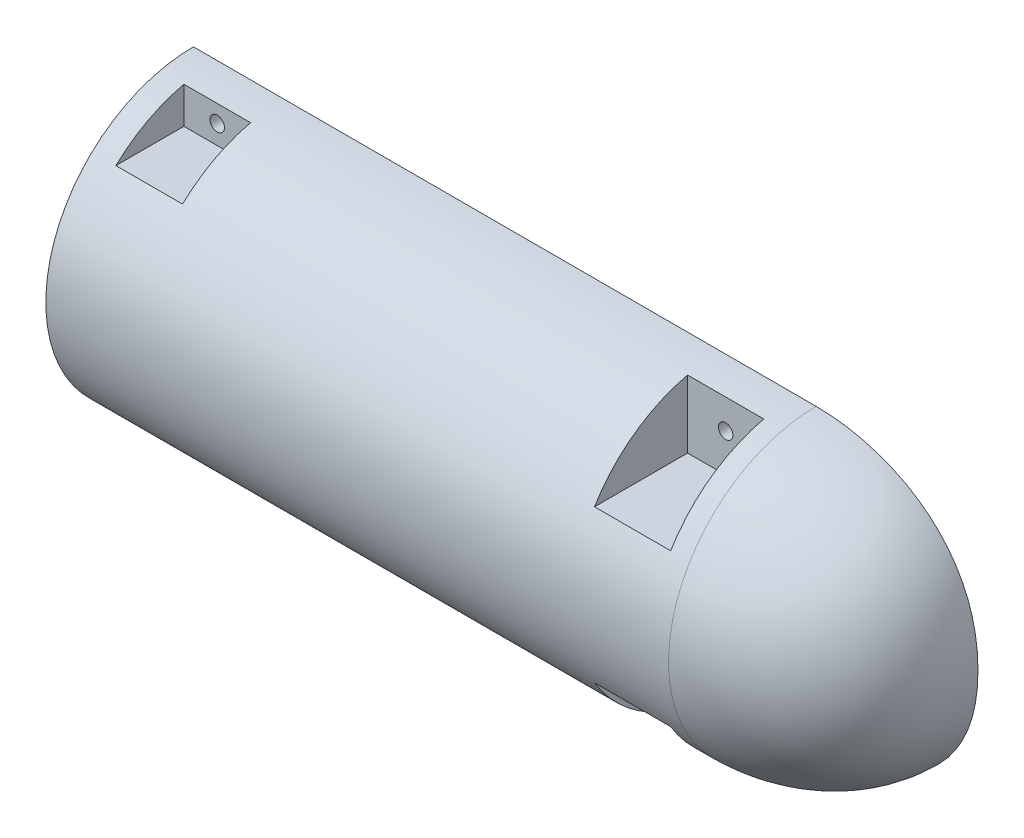
from build123d import *

# Parameters (mm, degrees)
REVOLVE1_ANGLE          = 180
CUT_EXTRUDE1_REACH      = 114.566
CUT_EXTRUDE1_END_RADIUS = 31
SKETCH2_W               = 14
SKETCH2_H               = 8.465653043
SKETCH2_W_2             = 16
SKETCH2_H_2             = 15
CUT_EXTRUDE2_REACH      = 114.566
SKETCH3_R               = 1.525
CUT_EXTRUDE3_DEPTH      = 10
CUT_EXTRUDE4_REACH      = 128.25
SKETCH6_R               = 8.5


with BuildPart() as part:
    # Sketch1 → Revolve1 (revolve)
    with BuildSketch(Plane.XY):
        with BuildLine():
            Line((6.218316837, 14), (6.218316837, 6))
            Line((6.218316837, 6), (3.718316837, 6))
            Line((3.718316837, 6), (3.718316837, 24.731367941))
            Line((3.718316837, 24.731367941), (-10.171408573, 24.731367941))
            Line((-10.171408573, 24.731367941), (-27.781683163, 24.731367941))
            Line((-27.781683163, 24.731367941), (-27.781683163, 26.554502519))
            Line((-27.781683163, 26.554502519), (-35.281683163, 26.554502519))
            Line((-35.281683163, 26.554502519), (-35.281683163, 24.731367941))
            Line((-35.281683163, 24.731367941), (-38.281683163, 24.731367941))
            Line((-38.281683163, 24.731367941), (-38.281683163, 21.534346957))
            Line((-38.281683163, 21.534346957), (-59.281683163, 20.416426404))
            Line((-59.281683163, 20.416426404), (-59.281683163, 24.731367941))
            Line((-59.281683163, 24.731367941), (-59.281683163, 31))
            Line((-59.281683163, 31), (-56.981683163, 31))
            Line((-56.981683163, 31), (71.518316837, 31))
            add(Edge.make_bspline(
                [(71.518316837, 31), (87.336893309, 31), (105.518316837, 21.771712161), (105.518316837, 0)],
                knots=[0, 0, 0, 0, 1, 1, 1, 1], degree=3))
            Line((105.518316837, 0), (100.518316813, 0))
            add(Edge.make_bspline(
                [(71.518316837, 26), (84.501211561, 26), (100.518316813, 18.460024777), (100.518316813, 0)],
                knots=[0, 0, 0, 0, 1, 1, 1, 1], degree=3))
            Line((71.518316837, 26), (71.518316837, 14))
            Line((71.518316837, 14), (6.218316837, 14))
        make_face()
    revolve(axis=Axis((-52.937293729, 0, 0), (1, 0, 0)), revolution_arc=REVOLVE1_ANGLE)

    # Cut-Extrude1: up to this cylinder (the profile starts inside it)
    cut_extrude1_end = Plane(origin=(6.118317, 0, 0), z_dir=(-1, 0, 0)) * Cylinder(CUT_EXTRUDE1_END_RADIUS, 398.932, mode=Mode.PRIVATE)
    # Sketch2 → Cut-Extrude1 (cut, up to the surface)
    with BuildSketch(Plane(origin=(0, 0, 7), x_dir=(-1, 0, 0), z_dir=(0, 0, -1)), mode=Mode.PRIVATE) as cut_extrude1_sk1:
        with Locations((47.281683163, 26.767173479)):
            Rectangle(SKETCH2_W, SKETCH2_H)
    cut_extrude1_tool1 = extrude(cut_extrude1_sk1.sketch, amount=-CUT_EXTRUDE1_REACH, mode=Mode.PRIVATE) & cut_extrude1_end
    add(cut_extrude1_tool1.solids().sort_by_distance((-47.281683, 26.767173, 7))[0], mode=Mode.SUBTRACT)
    # Sketch2 → Cut-Extrude1 (cut, up to the surface)
    with BuildSketch(Plane(origin=(0, 0, 7), x_dir=(-1, 0, 0), z_dir=(0, 0, -1)), mode=Mode.PRIVATE) as cut_extrude1_sk2:
        with Locations((-59.518316837, -23.5)):
            Rectangle(SKETCH2_W_2, SKETCH2_H_2)
    cut_extrude1_tool2 = extrude(cut_extrude1_sk2.sketch, amount=-CUT_EXTRUDE1_REACH, mode=Mode.PRIVATE) & cut_extrude1_end
    add(cut_extrude1_tool2.solids().sort_by_distance((59.518317, -23.5, 7))[0], mode=Mode.SUBTRACT)
    # Sketch2 → Cut-Extrude1 (cut, up to the surface)
    with BuildSketch(Plane(origin=(0, 0, 7), x_dir=(-1, 0, 0), z_dir=(0, 0, -1)), mode=Mode.PRIVATE) as cut_extrude1_sk3:
        with Locations((-59.518316837, 23.5)):
            Rectangle(SKETCH2_W_2, SKETCH2_H_2)
    cut_extrude1_tool3 = extrude(cut_extrude1_sk3.sketch, amount=-CUT_EXTRUDE1_REACH, mode=Mode.PRIVATE) & cut_extrude1_end
    add(cut_extrude1_tool3.solids().sort_by_distance((59.518317, 23.5, 7))[0], mode=Mode.SUBTRACT)
    # Sketch2 → Cut-Extrude1 (cut, up to the surface)
    with BuildSketch(Plane(origin=(0, 0, 7), x_dir=(-1, 0, 0), z_dir=(0, 0, -1)), mode=Mode.PRIVATE) as cut_extrude1_sk4:
        with Locations((47.281683163, -26.767173479)):
            Rectangle(SKETCH2_W, SKETCH2_H)
    cut_extrude1_tool4 = extrude(cut_extrude1_sk4.sketch, amount=-CUT_EXTRUDE1_REACH, mode=Mode.PRIVATE) & cut_extrude1_end
    add(cut_extrude1_tool4.solids().sort_by_distance((-47.281683, -26.767173, 7))[0], mode=Mode.SUBTRACT)

    # Sketch3 → Cut-Extrude2 (cut, up to next)
    with BuildSketch(Plane.XY.offset(7), mode=Mode.PRIVATE) as cut_extrude2_sk1:
        with Locations((-47.281683163, 26.534346957)):
            Circle(SKETCH3_R)
    cut_extrude2_tool1 = extrude(cut_extrude2_sk1.sketch, amount=-CUT_EXTRUDE2_REACH, mode=Mode.PRIVATE) & part.part
    # Sketch3 → Cut-Extrude2 (cut, up to next)
    with BuildSketch(Plane.XY.offset(7), mode=Mode.PRIVATE) as cut_extrude2_sk2:
        with Locations(Location((-47.281683163, -26.534346957, 0), (0, 0, 90))):
            Circle(SKETCH3_R)
    cut_extrude2_tool2 = extrude(cut_extrude2_sk2.sketch, amount=-CUT_EXTRUDE2_REACH, mode=Mode.PRIVATE) & part.part
    # Sketch3 → Cut-Extrude2 (cut, up to next)
    with BuildSketch(Plane.XY.offset(7), mode=Mode.PRIVATE) as cut_extrude2_sk3:
        with Locations((59.518316837, 24)):
            Circle(SKETCH3_R)
    cut_extrude2_tool3 = extrude(cut_extrude2_sk3.sketch, amount=-CUT_EXTRUDE2_REACH, mode=Mode.PRIVATE) & part.part
    # Sketch3 → Cut-Extrude2 (cut, up to next)
    with BuildSketch(Plane.XY.offset(7), mode=Mode.PRIVATE) as cut_extrude2_sk4:
        with Locations((59.518316837, -24)):
            Circle(SKETCH3_R)
    cut_extrude2_tool4 = extrude(cut_extrude2_sk4.sketch, amount=-CUT_EXTRUDE2_REACH, mode=Mode.PRIVATE) & part.part
    add(cut_extrude2_tool1.solids().sort_by_distance((-47.281683, 26.534347, 7))[0], mode=Mode.SUBTRACT)
    add(cut_extrude2_tool2.solids().sort_by_distance((-47.281683, -26.534347, 7))[0], mode=Mode.SUBTRACT)
    add(cut_extrude2_tool3.solids().sort_by_distance((59.518317, 24, 7))[0], mode=Mode.SUBTRACT)
    add(cut_extrude2_tool4.solids().sort_by_distance((59.518317, -24, 7))[0], mode=Mode.SUBTRACT)

    # Sketch5 → Cut-Extrude3 (cut)
    with BuildSketch(Plane(origin=(0, -31, 0), x_dir=(1, 0, 0), z_dir=(0, 1, 0))):
        Polygon((4.441941487, 0), (11.658819852, -12.5), (26.092576582, -12.5), (33.309454947, 0), (26.092576582, 12.5), (11.658819852, 12.5), align=None)
    extrude(amount=CUT_EXTRUDE3_DEPTH, mode=Mode.SUBTRACT)

    # Sketch6 → Cut-Extrude4 (cut, up to next)
    with BuildSketch(Plane(origin=(0, -31, 0), x_dir=(1, 0, 0), z_dir=(0, 1, 0)), mode=Mode.PRIVATE) as cut_extrude4_sk1:
        with Locations((81.518316837, 0)):
            Circle(SKETCH6_R)
    cut_extrude4_tool1 = extrude(cut_extrude4_sk1.sketch, amount=CUT_EXTRUDE4_REACH, mode=Mode.PRIVATE) & part.part
    add(cut_extrude4_tool1.solids().sort_by_distance((81.518317, -31, 0))[0], mode=Mode.SUBTRACT)


solid = part.part
